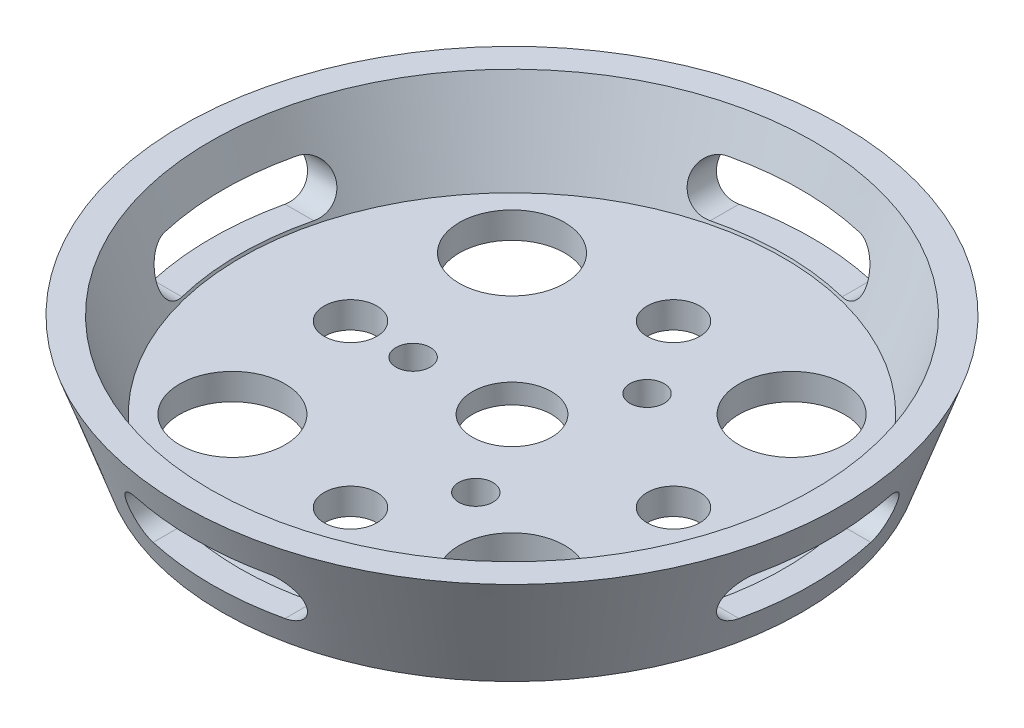
from build123d import *

# Parameters (mm, degrees)
SKETCH2_R          = 25
SKETCH1_R          = 22
SHELL1_T           = -2
SKETCH3_R          = 3
SKETCH3_R_2        = 2
SKETCH3_R_3        = 4
SKETCH3_R_4        = 1.3
CUT_EXTRUDE1_DEPTH = 37.362755832
CUT_EXTRUDE2_DEPTH = 31
CIRPATTERN1_COUNT  = 4
SKETCH5_R          = 5
CUT_EXTRUDE3_DEPTH = 0.5


with BuildPart() as part:
    # Sketch2 → Loft1 section 0
    with BuildSketch(Plane(origin=(0, 8.5, 0), x_dir=(1, 0, 0), z_dir=(0, 1, 0))):
        Circle(SKETCH2_R)
    # Sketch1 → Loft1 section 1
    with BuildSketch(Plane(origin=(0, 0, 0), x_dir=(1, 0, 0), z_dir=(0, 1, 0))):
        Circle(SKETCH1_R)
    loft()

    # Shell1
    shell1_openings = [part.faces().sort_by_distance(p)[0] for p in [
        (0, 8.5, 0),
    ]]
    offset(amount=SHELL1_T, openings=shell1_openings, kind=Kind.INTERSECTION)

    # Sketch3 → Cut-Extrude1 (cut, through all)
    with BuildSketch(Plane.XZ):
        with Locations(Location((0, 0, 0), (0, 0, 270))):
            Circle(SKETCH3_R)
        with Locations(Location((0, -12.25, 0), (0, 0, 270))):
            Circle(SKETCH3_R_2)
        with Locations(Location((-12.25, 0, 0), (0, 0, 270))):
            Circle(SKETCH3_R_2)
        with Locations(Location((0, 12.25, 0), (0, 0, 270))):
            Circle(SKETCH3_R_2)
        with Locations(Location((12.25, 0, 0), (0, 0, 270))):
            Circle(SKETCH3_R_2)
        with Locations(Location((-10.606601718, -10.606601718, 0), (0, 0, 270))):
            Circle(SKETCH3_R_3)
        with Locations(Location((-10.606601718, 10.606601718, 0), (0, 0, 270))):
            Circle(SKETCH3_R_3)
        with Locations(Location((10.606601718, 10.606601718, 0), (0, 0, 270))):
            Circle(SKETCH3_R_3)
        with Locations(Location((10.606601718, -10.606601718, 0), (0, 0, 270))):
            Circle(SKETCH3_R_3)
        with Locations(Location((-7.5, 0, 0), (0, 0, 270))):
            Circle(SKETCH3_R_4)
        with Locations(Location((3.75, 6.495190528, 0), (0, 0, 270))):
            Circle(SKETCH3_R_4)
        with Locations(Location((3.75, -6.495190528, 0), (0, 0, 270))):
            Circle(SKETCH3_R_4)
    extrude(amount=-CUT_EXTRUDE1_DEPTH, mode=Mode.SUBTRACT)

    # Sketch4 → Cut-Extrude2 (cut)
    with BuildSketch(Plane.XY):
        with BuildLine():
            Line((5, 2.2), (-5, 2.2))
            ThreePointArc((-5, 2.2), (-6.8, 4), (-5, 5.8))
            Line((-5, 5.8), (5, 5.8))
            ThreePointArc((5, 5.8), (6.8, 4), (5, 2.2))
        make_face()
    cut_extrude2 = extrude(amount=CUT_EXTRUDE2_DEPTH, mode=Mode.SUBTRACT)

    # CirPattern1: Cut-Extrude2 ×4 about axis
    cirpattern1_axis = Axis((0, 0, 0), (0, 1, 0))
    for i in range(1, CIRPATTERN1_COUNT):
        add(cut_extrude2.rotate(cirpattern1_axis, i * 360 / CIRPATTERN1_COUNT), mode=Mode.SUBTRACT)

    # Sketch5 → Cut-Extrude3 (cut)
    with BuildSketch(Plane.XZ):
        with Locations(Location((0, 0, 0), (0, 0, 270))):
            Circle(SKETCH5_R)
    extrude(amount=-CUT_EXTRUDE3_DEPTH, mode=Mode.SUBTRACT)


solid = part.part
